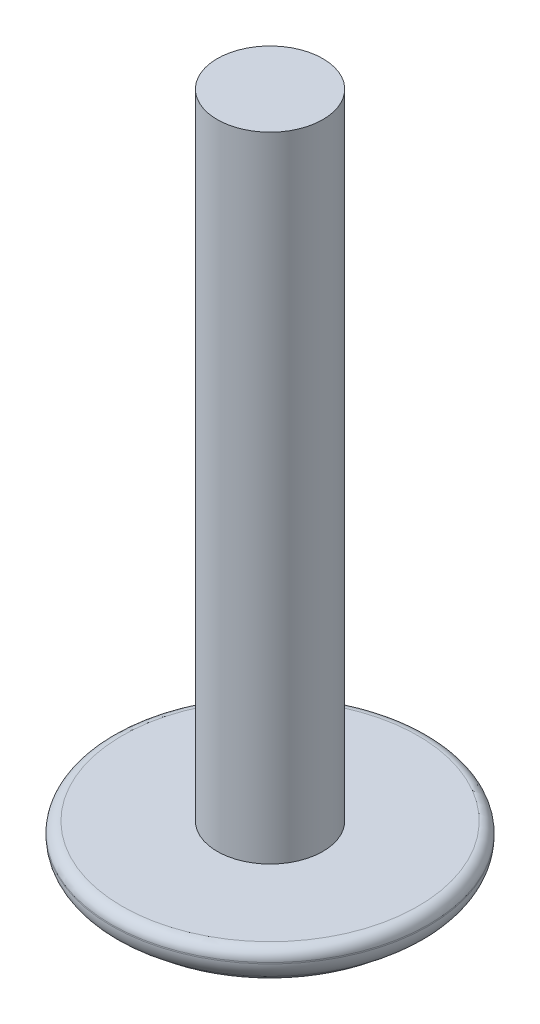
from build123d import *

# Parameters (mm, degrees)
SKETCH1_W = 30
SKETCH1_H = 2.5
FILLET1_R = 0.5
FILLET2_R = 1


with BuildPart() as part:
    # Sketch1 → Revolve1 (revolve)
    with BuildSketch(Plane.YZ, mode=Mode.PRIVATE) as revolve1_sk:
        with BuildLine():
            ThreePointArc((-1, 7.5), (-3.222184013, 4.038873605), (-4, 0))
            Line((-4, 0), (0, 0))
            Line((0, 0), (0, 7.5))
            Line((0, 7.5), (-1, 7.5))
        make_face()
        with Locations((15, 1.25)):
            Rectangle(SKETCH1_W, SKETCH1_H)
    revolve(revolve1_sk.sketch.rotate(Axis((0, -13.848615749, 0), (0, 1, 0)), 180), axis=Axis((0, -13.848615749, 0), (0, 1, 0)))

    # Fillet1
    fillet1_edges = [part.edges().sort_by_distance(p)[0] for p in [
        (0, 0, 7.5),
    ]]
    fillet(fillet1_edges, radius=FILLET1_R)

    # Fillet2
    fillet2_edges = [part.edges().sort_by_distance(p)[0] for p in [
        (0, -1, 7.5),
    ]]
    fillet(fillet2_edges, radius=FILLET2_R)


solid = part.part
